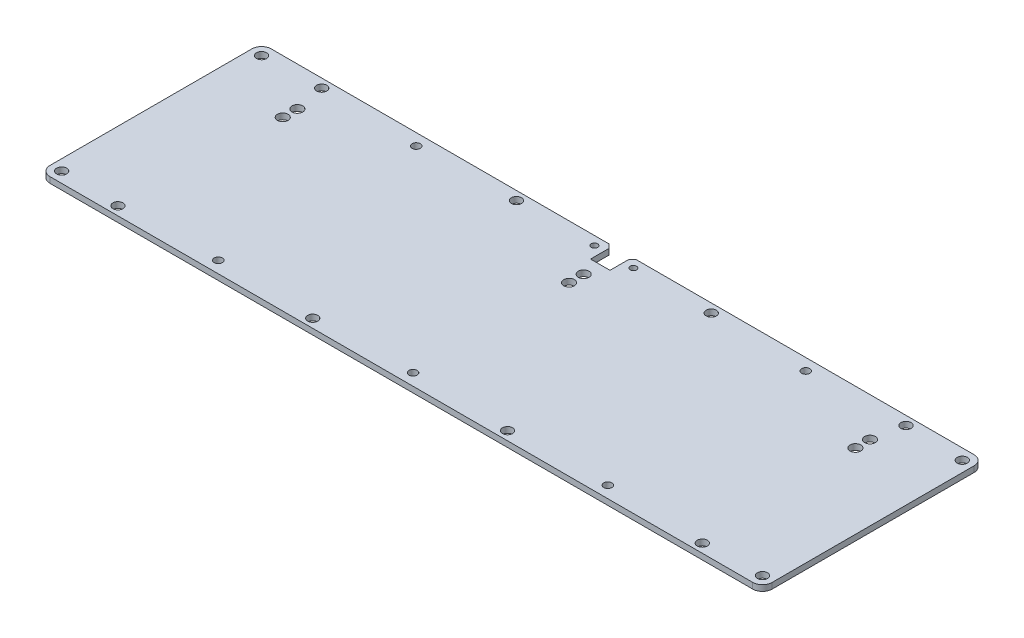
from build123d import *

# Parameters (mm, degrees)
SKETCH1_R           = 2.6
SKETCH1_R_2         = 1.65
SKETCH1_R_3         = 2.75
SKETCH1_R_4         = 2.1
BOSS_EXTRUDE1_DEPTH = 3


with BuildPart() as part:
    # Sketch1 → Boss-Extrude1 (new body)
    with BuildSketch(Plane(origin=(0, 0, 0), x_dir=(1, 0, 0), z_dir=(0, 1, 0))):
        with BuildLine():
            Line((3.317e-06, 108.599999792), (3.317e-06, 4.999999792))
            ThreePointArc((3.317e-06, 4.999999792), (1.464469411, 1.464465886), (5.000003317, -2.08e-07))
            Line((5.000003317, -2.08e-07), (365.775003317, -2.08e-07))
            ThreePointArc((365.775003317, -2.08e-07), (369.310537223, 1.464465886), (370.775003317, 4.999999792))
            Line((370.775003317, 4.999999792), (370.775003317, 108.599999792))
            ThreePointArc((370.775003317, 108.599999792), (369.310537223, 112.135533698), (365.775003317, 113.599999792))
            Line((365.775003317, 113.599999792), (192.387503319, 113.599999792))
            Line((192.387503319, 113.599999792), (190.387503319, 111.599999792))
            Line((190.387503319, 111.599999792), (190.387503319, 102.099999792))
            Line((190.387503319, 102.099999792), (180.387503319, 102.099999792))
            Line((180.387503319, 102.099999792), (180.387503319, 111.599999792))
            Line((180.387503319, 111.599999792), (178.387503319, 113.599999792))
            Line((178.387503319, 113.599999792), (5.000003317, 113.599999792))
            ThreePointArc((5.000003317, 113.599999792), (1.464469411, 112.135533698), (3.317e-06, 108.599999792))
        make_face()
        with Locations(Location((5.500003317, 108.099999792, 0), (0, 0, 270))):
            Circle(SKETCH1_R, mode=Mode.SUBTRACT)
        with Locations(Location((5.500003317, 5.499999792, 0), (0, 0, 270))):
            Circle(SKETCH1_R, mode=Mode.SUBTRACT)
        with Locations(Location((365.275003317, 5.499999792, 0), (0, 0, 270))):
            Circle(SKETCH1_R, mode=Mode.SUBTRACT)
        with Locations(Location((365.275003317, 108.099999792, 0), (0, 0, 270))):
            Circle(SKETCH1_R, mode=Mode.SUBTRACT)
        with Locations(Location((35.387503317, 4.499999792, 0), (0, 0, 270))):
            Circle(SKETCH1_R, mode=Mode.SUBTRACT)
        with Locations(Location((135.387503317, 4.499999792, 0), (0, 0, 270))):
            Circle(SKETCH1_R, mode=Mode.SUBTRACT)
        with Locations(Location((335.387503317, 4.499999792, 0), (0, 0, 270))):
            Circle(SKETCH1_R, mode=Mode.SUBTRACT)
        with Locations(Location((235.387503317, 4.499999792, 0), (0, 0, 270))):
            Circle(SKETCH1_R, mode=Mode.SUBTRACT)
        with Locations(Location((35.387503317, 109.099999792, 0), (0, 0, 270))):
            Circle(SKETCH1_R, mode=Mode.SUBTRACT)
        with Locations(Location((135.387503317, 109.099999792, 0), (0, 0, 270))):
            Circle(SKETCH1_R, mode=Mode.SUBTRACT)
        with Locations(Location((335.387503317, 109.099999792, 0), (0, 0, 270))):
            Circle(SKETCH1_R, mode=Mode.SUBTRACT)
        with Locations(Location((235.387503317, 109.099999792, 0), (0, 0, 270))):
            Circle(SKETCH1_R, mode=Mode.SUBTRACT)
        with Locations(Location((195.387503317, 109.099999792, 0), (0, 0, 270))):
            Circle(SKETCH1_R_2, mode=Mode.SUBTRACT)
        with Locations(Location((175.387503317, 109.099999792, 0), (0, 0, 270))):
            Circle(SKETCH1_R_2, mode=Mode.SUBTRACT)
        with Locations(Location((38.387503314, 86.099999792, 0), (0, 0, 270))):
            Circle(SKETCH1_R_3, mode=Mode.SUBTRACT)
        with Locations(Location((38.387503317, 93.599999792, 0), (0, 0, 270))):
            Circle(SKETCH1_R_3, mode=Mode.SUBTRACT)
        with Locations(Location((332.387503314, 86.099999792, 0), (0, 0, 270))):
            Circle(SKETCH1_R_3, mode=Mode.SUBTRACT)
        with Locations(Location((332.387503317, 93.599999792, 0), (0, 0, 270))):
            Circle(SKETCH1_R_3, mode=Mode.SUBTRACT)
        with Locations(Location((185.387503314, 86.099999792, 0), (0, 0, 270))):
            Circle(SKETCH1_R_3, mode=Mode.SUBTRACT)
        with Locations(Location((185.387503317, 93.599999792, 0), (0, 0, 270))):
            Circle(SKETCH1_R_3, mode=Mode.SUBTRACT)
        with Locations(Location((85.387503317, 107.599999792, 0), (0, 0, 270))):
            Circle(SKETCH1_R_4, mode=Mode.SUBTRACT)
        with Locations(Location((285.387503317, 107.599999792, 0), (0, 0, 270))):
            Circle(SKETCH1_R_4, mode=Mode.SUBTRACT)
        with Locations(Location((85.387503317, 5.999999792, 0), (0, 0, 270))):
            Circle(SKETCH1_R_4, mode=Mode.SUBTRACT)
        with Locations(Location((185.387503317, 5.999999792, 0), (0, 0, 270))):
            Circle(SKETCH1_R_4, mode=Mode.SUBTRACT)
        with Locations(Location((285.387503317, 5.999999792, 0), (0, 0, 270))):
            Circle(SKETCH1_R_4, mode=Mode.SUBTRACT)
    extrude(amount=-BOSS_EXTRUDE1_DEPTH)


solid = part.part
